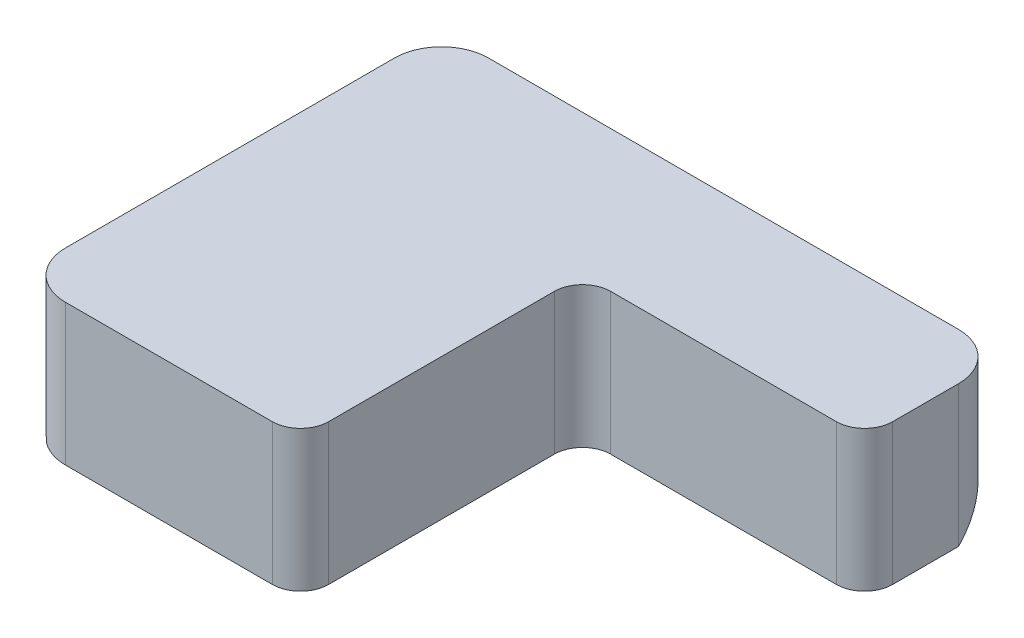
from build123d import *

# Parameters (mm, degrees)
BOSS_EXTRUDE1_DEPTH = 15
CHAMFER1_SIZE       = 5
CHAMFER2_SIZE       = 2
FILLET1_R           = 3
FILLET2_R           = 5


with BuildPart() as part:
    # Sketch1 → Boss-Extrude1 (new body)
    with BuildSketch(Plane(origin=(0, 0, 0), x_dir=(1, 0, 0), z_dir=(0, 1, 0))):
        Polygon((0, 0), (30, 0), (30, 15), (-30, 15), (-30, -30), (0, -30), align=None)
    extrude(amount=BOSS_EXTRUDE1_DEPTH)

    # Chamfer1
    chamfer1_edges = [part.edges().sort_by_distance(p)[0] for p in [
        (0, 0, -15),
    ]]
    chamfer(chamfer1_edges, length=CHAMFER1_SIZE)

    # Chamfer2
    chamfer2_edges = [part.edges().sort_by_distance(p)[0] for p in [
        (-30, 0, 10),
    ]]
    chamfer(chamfer2_edges, length=CHAMFER2_SIZE)

    # Fillet1
    fillet1_edges = [part.edges().sort_by_distance(p)[0] for p in [
        (0, 7.5, 30),
        (30, 7.5, 0),
        (0, 7.5, 0),
    ]]
    fillet(fillet1_edges, radius=FILLET1_R)

    # Fillet2
    fillet2_edges = [part.edges().sort_by_distance(p)[0] for p in [
        (30, 10, -15),
        (-30, 8.5, 30),
        (-30, 10, -15),
    ]]
    fillet(fillet2_edges, radius=FILLET2_R)


solid = part.part
